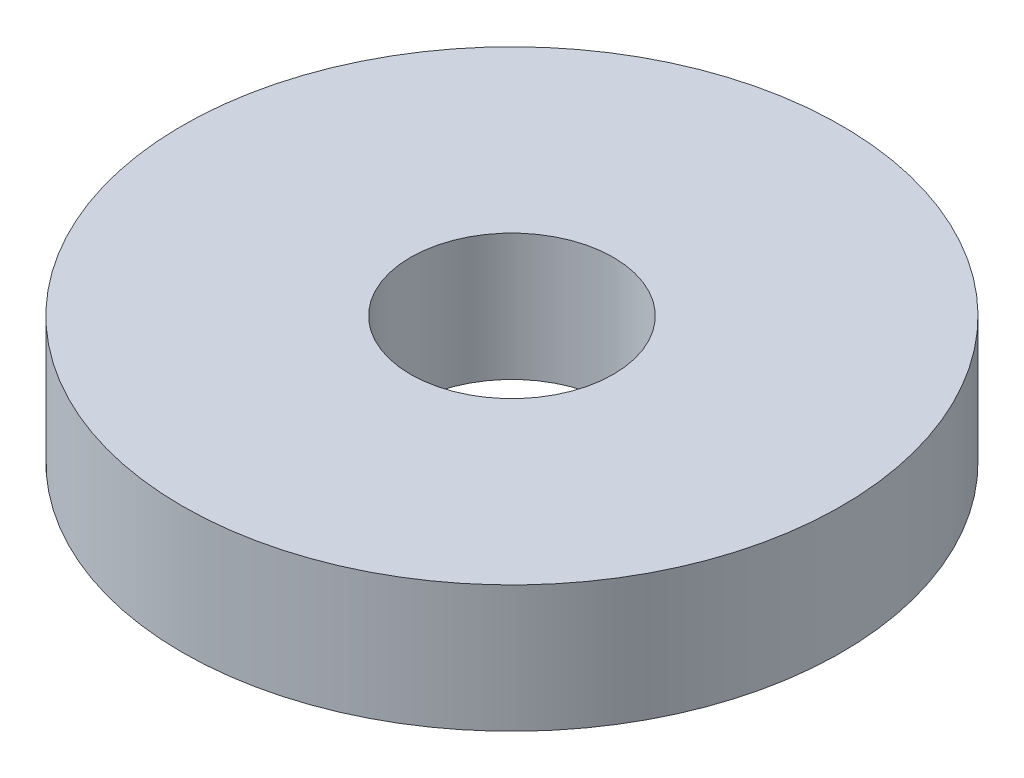
from build123d import *

# Parameters (mm, degrees)
SKETCH_1_R      = 65
SKETCH_1_R_2    = 20
EXTRUDE_1_DEPTH = 25


with BuildPart() as part:
    # 草图1 → 凸台-拉伸1 (new body)
    with BuildSketch(Plane(origin=(0, 0, 0), x_dir=(1, 0, 0), z_dir=(0, 1, 0))):
        with Locations(Location((0, 0, 0), (0, 0, 270))):
            Circle(SKETCH_1_R)
        with Locations(Location((0, 0, 0), (0, 0, 270))):
            Circle(SKETCH_1_R_2, mode=Mode.SUBTRACT)
    extrude(amount=EXTRUDE_1_DEPTH)


solid = part.part
